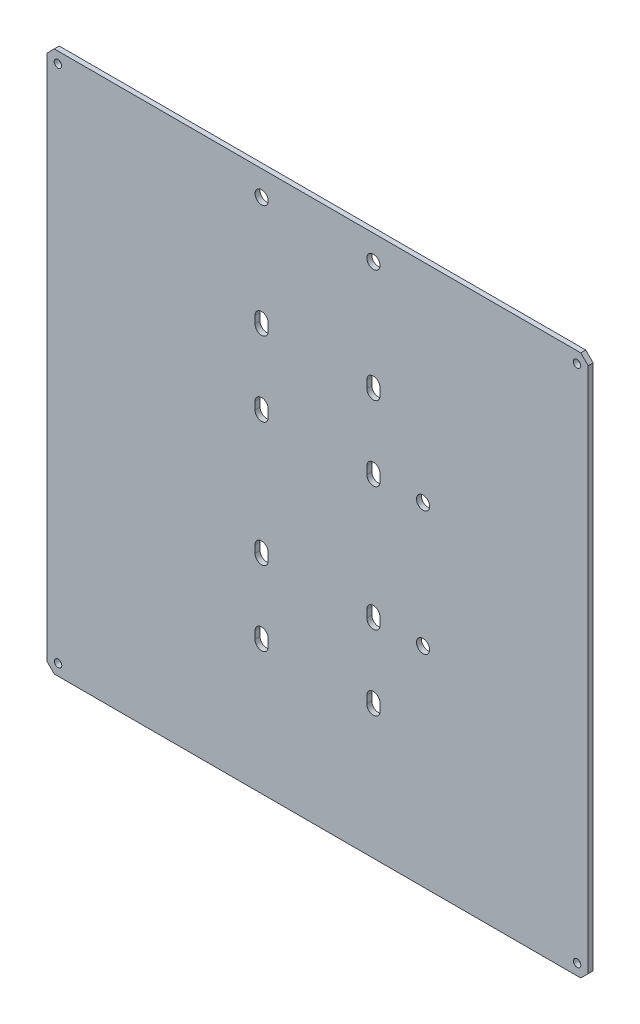
from build123d import *

# Parameters (mm, degrees)
SKETCH1_W           = 218
SKETCH1_H           = 218
SKETCH1_R           = 1.5
SKETCH1_R_2         = 2.65
BOSS_EXTRUDE1_DEPTH = 2
CHAMFER1_SIZE       = 3


with BuildPart() as part:
    # Sketch1 → Boss-Extrude1 (new body)
    with BuildSketch(Plane.XY):
        Rectangle(SKETCH1_W, SKETCH1_H)
        with Locations((-104.526250503, 104.526250503)):
            Circle(SKETCH1_R, mode=Mode.SUBTRACT)
        with Locations((104.473749497, 104.473749497)):
            Circle(SKETCH1_R, mode=Mode.SUBTRACT)
        with Locations((104.526250503, -104.526250503)):
            Circle(SKETCH1_R, mode=Mode.SUBTRACT)
        with Locations((-104.473749497, -104.473749497)):
            Circle(SKETCH1_R, mode=Mode.SUBTRACT)
        with Locations((42.5, 25)):
            Circle(SKETCH1_R_2, mode=Mode.SUBTRACT)
        with Locations((42.5, -25)):
            Circle(SKETCH1_R_2, mode=Mode.SUBTRACT)
        with Locations((-22.5, 99)):
            Circle(SKETCH1_R_2, mode=Mode.SUBTRACT)
        with Locations((22.5, 99)):
            Circle(SKETCH1_R_2, mode=Mode.SUBTRACT)
        with BuildLine():
            Line((-19.85, 56.5), (-19.85, 53.5))
            ThreePointArc((-19.85, 53.5), (-22.5, 50.85), (-25.15, 53.5))
            Line((-25.15, 53.5), (-25.15, 56.5))
            ThreePointArc((-25.15, 56.5), (-22.5, 59.15), (-19.85, 56.5))
        make_face(mode=Mode.SUBTRACT)
        with BuildLine():
            Line((-25.15, 23.5), (-25.15, 26.5))
            ThreePointArc((-25.15, 26.5), (-22.5, 29.15), (-19.85, 26.5))
            Line((-19.85, 26.5), (-19.85, 23.5))
            ThreePointArc((-19.85, 23.5), (-22.5, 20.85), (-25.15, 23.5))
        make_face(mode=Mode.SUBTRACT)
        with BuildLine():
            Line((25.15, 56.5), (25.15, 53.5))
            ThreePointArc((25.15, 53.5), (22.5, 50.85), (19.85, 53.5))
            Line((19.85, 53.5), (19.85, 56.5))
            ThreePointArc((19.85, 56.5), (22.5, 59.15), (25.15, 56.5))
        make_face(mode=Mode.SUBTRACT)
        with BuildLine():
            Line((19.85, 23.5), (19.85, 26.5))
            ThreePointArc((19.85, 26.5), (22.5, 29.15), (25.15, 26.5))
            Line((25.15, 26.5), (25.15, 23.5))
            ThreePointArc((25.15, 23.5), (22.5, 20.85), (19.85, 23.5))
        make_face(mode=Mode.SUBTRACT)
        with BuildLine():
            Line((25.15, -23.5), (25.15, -26.5))
            ThreePointArc((25.15, -26.5), (22.5, -29.15), (19.85, -26.5))
            Line((19.85, -26.5), (19.85, -23.5))
            ThreePointArc((19.85, -23.5), (22.5, -20.85), (25.15, -23.5))
        make_face(mode=Mode.SUBTRACT)
        with BuildLine():
            Line((19.85, -56.5), (19.85, -53.5))
            ThreePointArc((19.85, -53.5), (22.5, -50.85), (25.15, -53.5))
            Line((25.15, -53.5), (25.15, -56.5))
            ThreePointArc((25.15, -56.5), (22.5, -59.15), (19.85, -56.5))
        make_face(mode=Mode.SUBTRACT)
        with BuildLine():
            Line((-19.85, -23.5), (-19.85, -26.5))
            ThreePointArc((-19.85, -26.5), (-22.5, -29.15), (-25.15, -26.5))
            Line((-25.15, -26.5), (-25.15, -23.5))
            ThreePointArc((-25.15, -23.5), (-22.5, -20.85), (-19.85, -23.5))
        make_face(mode=Mode.SUBTRACT)
        with BuildLine():
            Line((-25.15, -56.5), (-25.15, -53.5))
            ThreePointArc((-25.15, -53.5), (-22.5, -50.85), (-19.85, -53.5))
            Line((-19.85, -53.5), (-19.85, -56.5))
            ThreePointArc((-19.85, -56.5), (-22.5, -59.15), (-25.15, -56.5))
        make_face(mode=Mode.SUBTRACT)
    extrude(amount=BOSS_EXTRUDE1_DEPTH)

    # Chamfer1
    chamfer1_edges = [part.edges().sort_by_distance(p)[0] for p in [
        (109, -109, 1),
        (-109, -109, 1),
        (-109, 109, 1),
        (109, 109, 1),
    ]]
    chamfer(chamfer1_edges, length=CHAMFER1_SIZE)


solid = part.part
